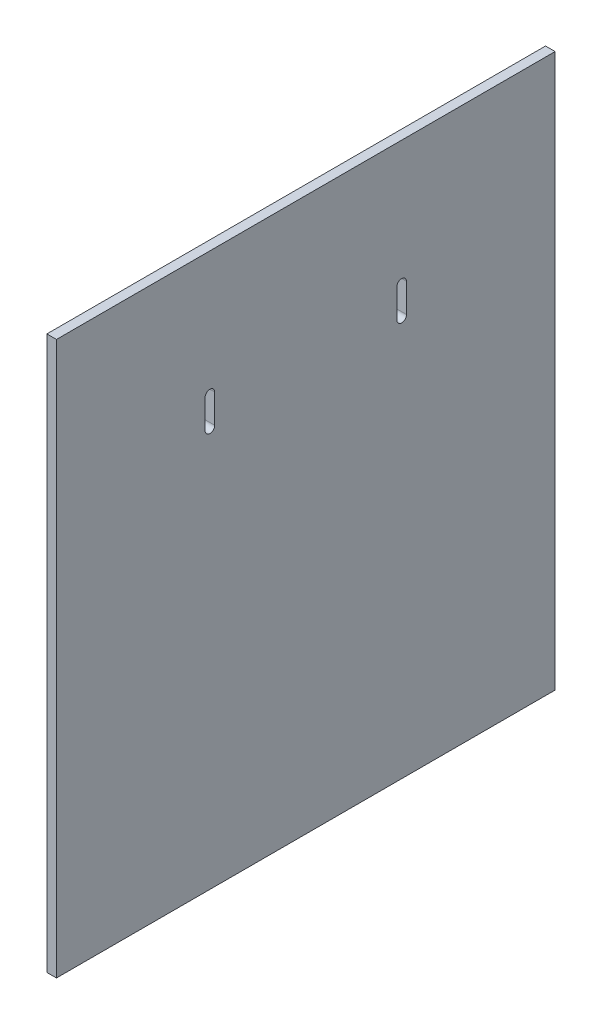
from build123d import *

# Parameters (mm, degrees)
CROQUIS1_W              = 156
CROQUIS1_H              = 173
SALIENTE_EXTRUIR1_DEPTH = 3
CORTAR_EXTRUIR1_DEPTH   = 233.967808935


with BuildPart() as part:
    # Croquis1 → Saliente-Extruir1 (new body)
    with BuildSketch(Plane(origin=(0, 0, 0), x_dir=(0, 0, -1), z_dir=(1, 0, 0))):
        with Locations((78, 86.5)):
            Rectangle(CROQUIS1_W, CROQUIS1_H)
    extrude(amount=SALIENTE_EXTRUIR1_DEPTH)

    # Croquis2 → Cortar-Extruir1 (cut, through all)
    with BuildSketch(Plane(origin=(3, 0, 0), x_dir=(0, 0, -1), z_dir=(1, 0, 0))):
        with BuildLine():
            Line((46.5, 125), (46.5, 134))
            ThreePointArc((46.5, 134), (48, 135.5), (49.5, 134))
            Line((49.5, 134), (49.5, 125))
            ThreePointArc((49.5, 125), (48, 123.5), (46.5, 125))
        make_face()
        with BuildLine():
            Line((109.5, 125), (109.5, 134))
            ThreePointArc((109.5, 134), (108, 135.5), (106.5, 134))
            Line((106.5, 134), (106.5, 125))
            ThreePointArc((106.5, 125), (108, 123.5), (109.5, 125))
        make_face()
    extrude(amount=-CORTAR_EXTRUIR1_DEPTH, mode=Mode.SUBTRACT)


solid = part.part
